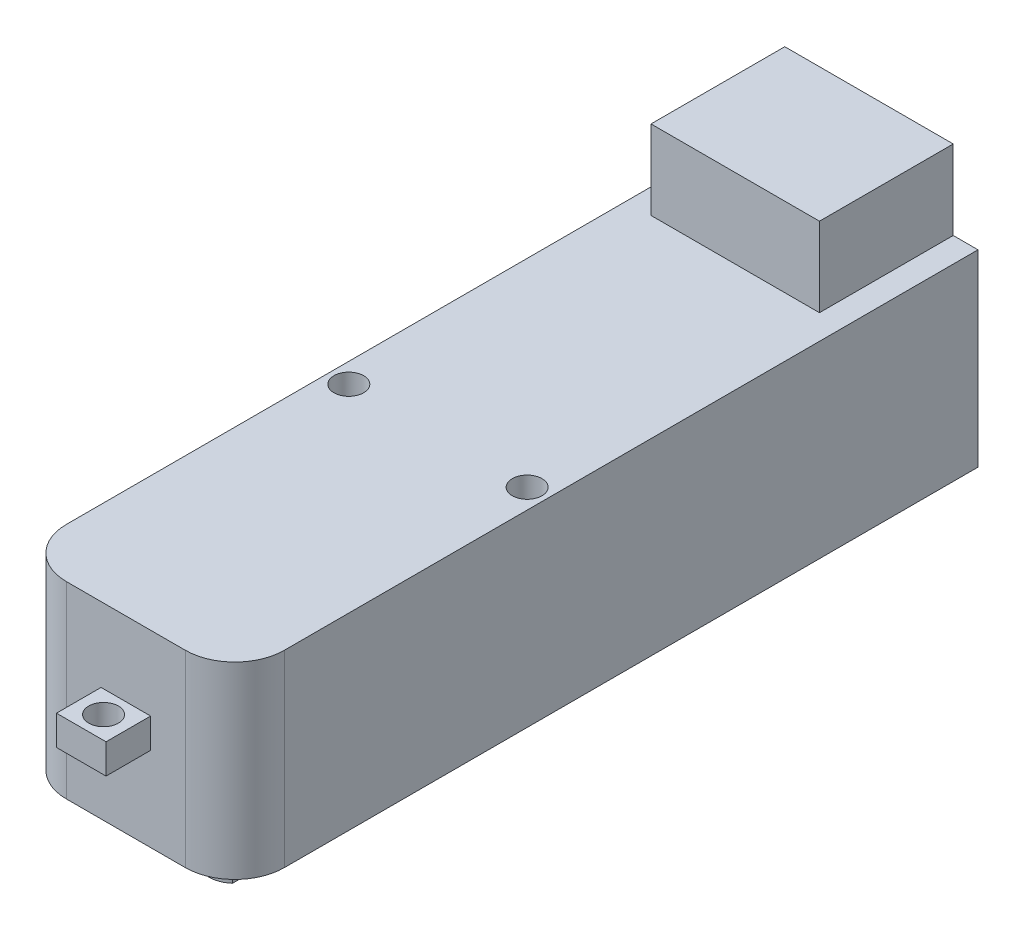
from build123d import *

# Parameters (mm, degrees)
SKETCH1_W               = 22
SKETCH1_H               = 75
BOSS_EXTRUDE1_DEPTH     = 19
SKETCH2_W               = 17
SKETCH2_H               = 13.5
BOSS_EXTRUDE2_DEPTH     = 8
FILLET1_R               = 5
SKETCH4_R               = 2.65
BOSS_EXTRUDE3_DEPTH     = 8
CUT_EXTRUDE1_DEPTH      = 83.692200358
CUT_EXTRUDE1_DEPTH_BACK = 83.692200358
SKETCH5_R               = 1.5
SKETCH6_R               = 2
SKETCH6_R_2             = 2.65
BOSS_EXTRUDE4_DEPTH     = 2
CUT_EXTRUDE2_DEPTH      = 86.638776264
CUT_EXTRUDE2_DEPTH_BACK = 8
SKETCH8_W               = 5
SKETCH8_H               = 3
BOSS_EXTRUDE5_DEPTH     = 4.5
SKETCH9_R               = 1.5
CUT_EXTRUDE3_DEPTH      = 3


with BuildPart() as part:
    # Sketch1 → Boss-Extrude1 (new body)
    with BuildSketch(Plane(origin=(0, 0, 0), x_dir=(1, 0, 0), z_dir=(0, 1, 0))):
        with Locations((11, 37.5)):
            Rectangle(SKETCH1_W, SKETCH1_H)
    extrude(amount=BOSS_EXTRUDE1_DEPTH)

    # Sketch2 → Boss-Extrude2 (add)
    with BuildSketch(Plane(origin=(0, 19, 0), x_dir=(1, 0, 0), z_dir=(0, 1, 0))):
        with Locations((11, 68.25)):
            Rectangle(SKETCH2_W, SKETCH2_H)
    extrude(amount=BOSS_EXTRUDE2_DEPTH)

    # Fillet1
    fillet1_edges = [part.edges().sort_by_distance(p)[0] for p in [
        (22, 9.5, 0),
        (0, 9.5, 0),
    ]]
    fillet(fillet1_edges, radius=FILLET1_R)

    # Sketch4 → Boss-Extrude3 (add)
    with BuildSketch(Plane.XZ):
        with Locations(Location((11, -11, 0), (0, 0, 270))):
            Circle(SKETCH4_R)
    extrude(amount=BOSS_EXTRUDE3_DEPTH)

    # Sketch5 → Cut-Extrude1 (cut, two sides: drawn at the far end of the back side and taken through both)
    with BuildSketch(Plane.XZ.offset(-CUT_EXTRUDE1_DEPTH_BACK)):
        with Locations(Location((20, -31.5, 0), (0, 0, 270))):
            Circle(SKETCH5_R)
        with Locations(Location((2, -31.5, 0), (0, 0, 270))):
            Circle(SKETCH5_R)
    extrude(amount=CUT_EXTRUDE1_DEPTH + CUT_EXTRUDE1_DEPTH_BACK, mode=Mode.SUBTRACT)

    # Sketch6 → Boss-Extrude4 (add)
    with BuildSketch(Plane.XZ):
        with Locations(Location((11, -22.15, 0), (0, 0, 270))):
            Circle(SKETCH6_R)
        with Locations(Location((11, -11, 0), (0, 0, 270))):
            Circle(SKETCH6_R_2)
    extrude(amount=BOSS_EXTRUDE4_DEPTH)

    # Sketch7 → Cut-Extrude2 (cut, two sides: drawn at the far end of the back side and taken through both)
    with BuildSketch(Plane.XZ.offset(8).offset(-CUT_EXTRUDE2_DEPTH_BACK)):
        with BuildLine():
            Line((12.75, -9.010025126), (12.75, -12.989974874))
            ThreePointArc((12.75, -12.989974874), (13.65, -11), (12.75, -9.010025126))
        make_face()
        with BuildLine():
            Line((9.25, -9.010025126), (9.25, -12.989974874))
            ThreePointArc((9.25, -12.989974874), (8.35, -11), (9.25, -9.010025126))
        make_face()
    extrude(amount=CUT_EXTRUDE2_DEPTH + CUT_EXTRUDE2_DEPTH_BACK, mode=Mode.SUBTRACT)

    # Sketch8 → Boss-Extrude5 (add)
    with BuildSketch(Plane.XY):
        with Locations((11, 10)):
            Rectangle(SKETCH8_W, SKETCH8_H)
    extrude(amount=BOSS_EXTRUDE5_DEPTH)

    # Sketch9 → Cut-Extrude3 (cut)
    with BuildSketch(Plane(origin=(0, 11.5, 0), x_dir=(1, 0, 0), z_dir=(0, 1, 0))):
        with Locations(Location((11, -2.25, 0), (0, 0, 180))):
            Circle(SKETCH9_R)
    extrude(amount=-CUT_EXTRUDE3_DEPTH, mode=Mode.SUBTRACT)


solid = part.part
